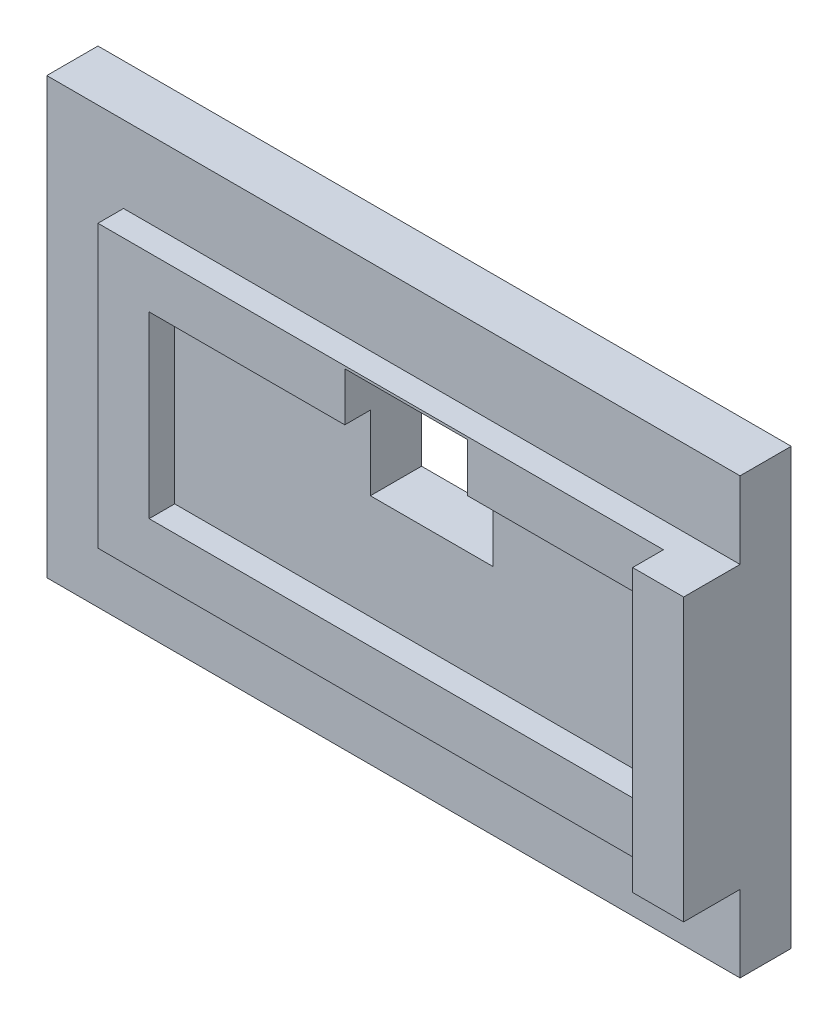
from build123d import *

# Parameters (mm, degrees)
SKETCH1_W           = 306.04968
SKETCH1_H           = 215.9
SKETCH1_W_2         = 255.24968
SKETCH1_H_2         = 165.1
BOSS_EXTRUDE1_DEPTH = 25.4
SKETCH10_W          = 306.04968
SKETCH10_H          = 139.69956566
SKETCH10_W_2        = 255.24968
SKETCH10_H_2        = 88.89956566
BOSS_EXTRUDE6_DEPTH = 12.7
SKETCH12_W          = 25.328039302
SKETCH12_H          = 139.69956566
BOSS_EXTRUDE7_DEPTH = 15.30096
SKETCH14_W          = 60.96
SKETCH14_H          = 60.96
CUT_EXTRUDE1_DEPTH  = 195.734349014
SKETCH5_W           = 25.4
SKETCH5_H           = 215.9
BOSS_EXTRUDE4_DEPTH = 38.1


with BuildPart() as part:
    # Sketch1 → Boss-Extrude1 (new body)
    # profile 1 of 2: a face of its own
    with BuildSketch(Plane.XY):
        Rectangle(SKETCH1_W, SKETCH1_H)
        Rectangle(SKETCH1_W_2, SKETCH1_H_2, mode=Mode.SUBTRACT)
    # profile 2 of 2: a face of its own
    with BuildSketch(Plane.XY):
        Rectangle(SKETCH1_W_2, SKETCH1_H_2)
    extrude(amount=BOSS_EXTRUDE1_DEPTH)

    # Sketch10 → Boss-Extrude6 (add)
    with BuildSketch(Plane.XY.offset(25.4)):
        Rectangle(SKETCH10_W, SKETCH10_H)
        Rectangle(SKETCH10_W_2, SKETCH10_H_2, mode=Mode.SUBTRACT)
    extrude(amount=BOSS_EXTRUDE6_DEPTH)

    # Sketch12 → Boss-Extrude7 (add)
    with BuildSketch(Plane.XY.offset(38.1)):
        with Locations((140.360820349, 0)):
            Rectangle(SKETCH12_W, SKETCH12_H)
    extrude(amount=BOSS_EXTRUDE7_DEPTH)

    # Sketch14 → Cut-Extrude1 (cut, through all)
    with BuildSketch(Plane(origin=(0, 0, 0), x_dir=(-1, 0, 0), z_dir=(0, 0, -1))):
        with Locations((0, 38.1)):
            Rectangle(SKETCH14_W, SKETCH14_H)
    extrude(amount=-CUT_EXTRUDE1_DEPTH, mode=Mode.SUBTRACT)

    # Sketch5 → Boss-Extrude4 (add)
    with BuildSketch(Plane.ZY.offset(153.02484)):
        with Locations((12.7, 0)):
            Rectangle(SKETCH5_W, SKETCH5_H)
    extrude(amount=BOSS_EXTRUDE4_DEPTH)


solid = part.part
